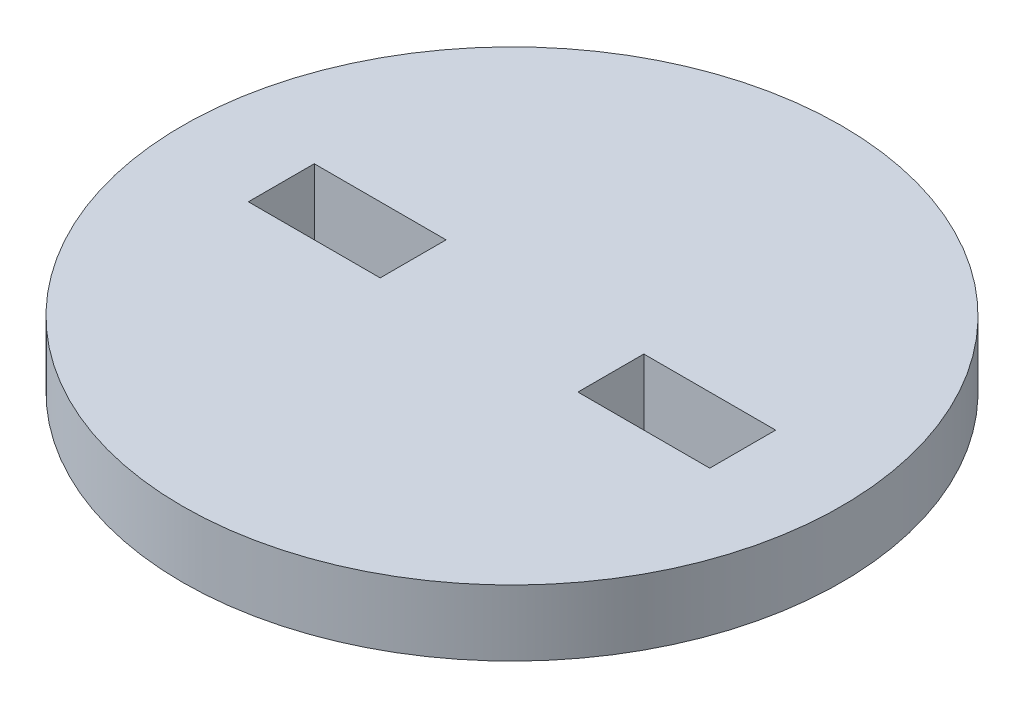
from build123d import *

# Parameters (mm, degrees)
SKETCH1_R           = 20
SKETCH1_W           = 8
SKETCH1_H           = 4
BOSS_EXTRUDE1_DEPTH = 4


with BuildPart() as part:
    # Sketch1 → Boss-Extrude1 (new body)
    with BuildSketch(Plane(origin=(0, 0, 0), x_dir=(1, 0, 0), z_dir=(0, 1, 0))):
        with Locations(Location((0, 0, 0), (0, 0, 270))):
            Circle(SKETCH1_R)
        with Locations((-10, 0)):
            Rectangle(SKETCH1_W, SKETCH1_H, mode=Mode.SUBTRACT)
        with Locations((10, 0)):
            Rectangle(SKETCH1_W, SKETCH1_H, mode=Mode.SUBTRACT)
    extrude(amount=BOSS_EXTRUDE1_DEPTH)


solid = part.part
